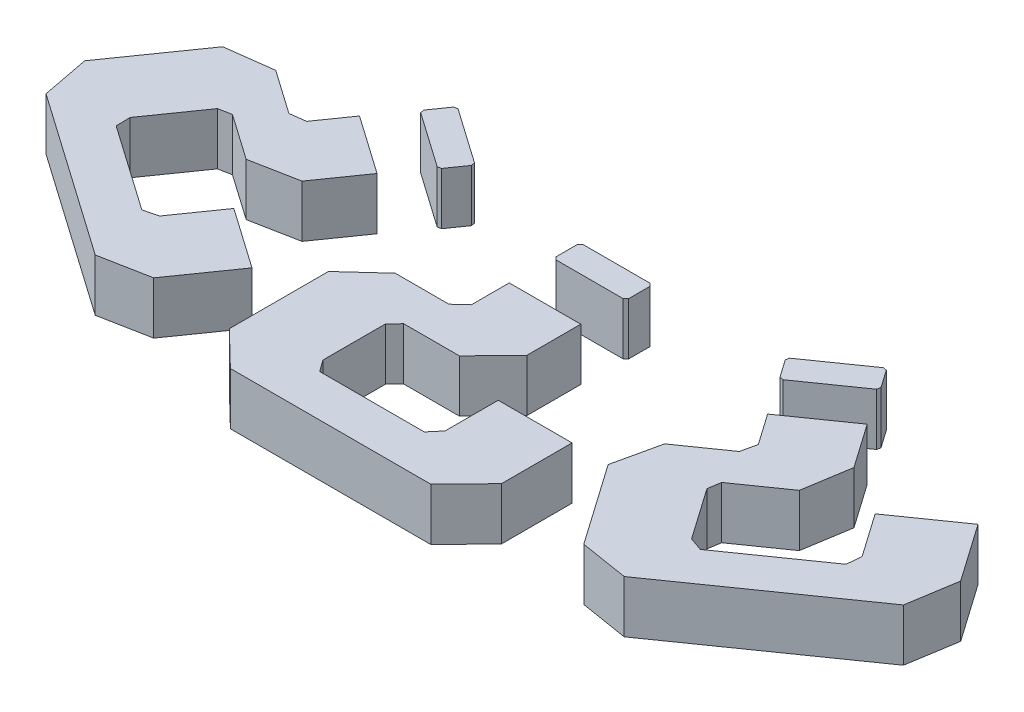
from build123d import *

# Parameters (mm, degrees)
EXTRUDE_1_DEPTH   = 3
EXTRUDE_1_2_DEPTH = 3
EXTRUDE_1_3_DEPTH = 3
EXTRUDE_1_4_DEPTH = 3
EXTRUDE_1_5_DEPTH = 3
EXTRUDE_1_6_DEPTH = 3


with BuildPart() as part:
    # 草图1 → 凸台-拉伸1 (new body)
    with BuildSketch(Plane(origin=(0, 0, 0), x_dir=(1, 0, 0), z_dir=(0, 1, 0))):
        Polygon((133.478301119, -68.092703376), (133.478301119, -72.145504343), (131.48062664, -74.205189433), (119.966187708, -74.205189433), (117.95433315, -72.25390546), (117.95433315, -66.562560774), (119.959309081, -64.73036938), (123.040683717, -64.73036938), (123.716375585, -64.112907192), (123.716375585, -61.937424195), (127.822595537, -61.937424195), (127.822595537, -65.033377491), (125.915941831, -66.999216397), (122.716168825, -66.999216397), (122.200795542, -67.530587588), (122.200795542, -71.128235111), (122.68139591, -71.791053989), (128.688979458, -71.791053989), (129.236737634, -71.145272993), (129.236737634, -68.092703376), align=None)
    extrude(amount=EXTRUDE_1_DEPTH)


with BuildPart() as body_2:
    # 草图1 → Extrude 1 2 (new body)
    with BuildSketch(Plane(origin=(0, 0, 0), x_dir=(1, 0, 0), z_dir=(0, 1, 0))):
        Polygon((127.771950867, -59.449350686), (127.927636292, -59.293665261), (127.927636292, -58.065036111), (127.771950867, -57.909350686), (123.91612256, -57.909350686), (123.760437135, -58.065036111), (123.760437135, -59.293665261), (123.91612256, -59.449350686), align=None)
    extrude(amount=EXTRUDE_1_2_DEPTH)


with BuildPart() as body_3:
    # 草图1 → Extrude 1 3 (new body)
    with BuildSketch(Plane(origin=(0, 0, 0), x_dir=(1, 0, 0), z_dir=(0, 1, 0))):
        Polygon((142.798648209, -61.22231729), (142.364367802, -63.926249886), (139.743267203, -65.761564284), (139.625880119, -66.492444053), (141.689405964, -69.439464376), (142.463268029, -69.706752768), (147.384392373, -66.260944405), (147.462684841, -65.4177704), (145.711802838, -62.917251758), (149.186288237, -60.48439089), (151.510879373, -63.804251087), (151.055867074, -66.637265347), (141.623790884, -73.241676197), (138.856565602, -72.797230309), (135.592144399, -68.135153675), (136.183622722, -65.484303399), (138.707737054, -63.716899516), (138.907069668, -62.823543169), (137.659263883, -61.041491825), (141.022882351, -58.686260818), align=None)
    extrude(amount=EXTRUDE_1_3_DEPTH)


with BuildPart() as body_4:
    # 草图1 → Extrude 1 4 (new body)
    with BuildSketch(Plane(origin=(0, 0, 0), x_dir=(1, 0, 0), z_dir=(0, 1, 0))):
        Polygon((138.670988617, -55.415704758), (135.512478977, -57.627317017), (135.474246434, -57.844144543), (136.178959164, -58.850578623), (136.395786689, -58.888811166), (139.554296329, -56.677198906), (139.592528872, -56.460371381), (138.887816143, -55.453937301), align=None)
    extrude(amount=EXTRUDE_1_4_DEPTH)


with BuildPart() as body_5:
    # 草图1 → Extrude 1 5 (new body)
    with BuildSketch(Plane(origin=(0, 0, 0), x_dir=(1, 0, 0), z_dir=(0, 1, 0))):
        Polygon((112.700364747, -62.827706461), (110.010966593, -63.344415781), (107.389865994, -61.509101383), (106.66291492, -61.64876921), (104.599389075, -64.595789533), (104.61289656, -65.414400018), (109.534020904, -68.86020838), (110.353122896, -68.64539674), (112.104004899, -66.144878099), (115.578490298, -68.577738967), (113.253899162, -71.897599164), (110.436113196, -72.438975407), (101.004037005, -65.834564557), (100.475232738, -63.082213934), (103.739653942, -58.4201373), (106.432935885, -58.069300924), (108.957050218, -59.836704806), (109.864706353, -59.718470327), (111.112512138, -57.936418982), (114.476130606, -60.291649989), align=None)
    extrude(amount=EXTRUDE_1_5_DEPTH)


with BuildPart() as body_6:
    # 草图1 → Extrude 1 6 (new body)
    with BuildSketch(Plane(origin=(0, 0, 0), x_dir=(1, 0, 0), z_dir=(0, 1, 0))):
        Polygon((116.74505297, -56.962996751), (113.58654333, -54.751384491), (113.369715805, -54.789617034), (112.665003075, -55.796051114), (112.703235618, -56.012878639), (115.861745258, -58.224490899), (116.078572783, -58.186258356), (116.783285513, -57.179824276), align=None)
    extrude(amount=EXTRUDE_1_6_DEPTH)


solid = Compound([part.part, body_2.part, body_3.part, body_4.part, body_5.part, body_6.part])
